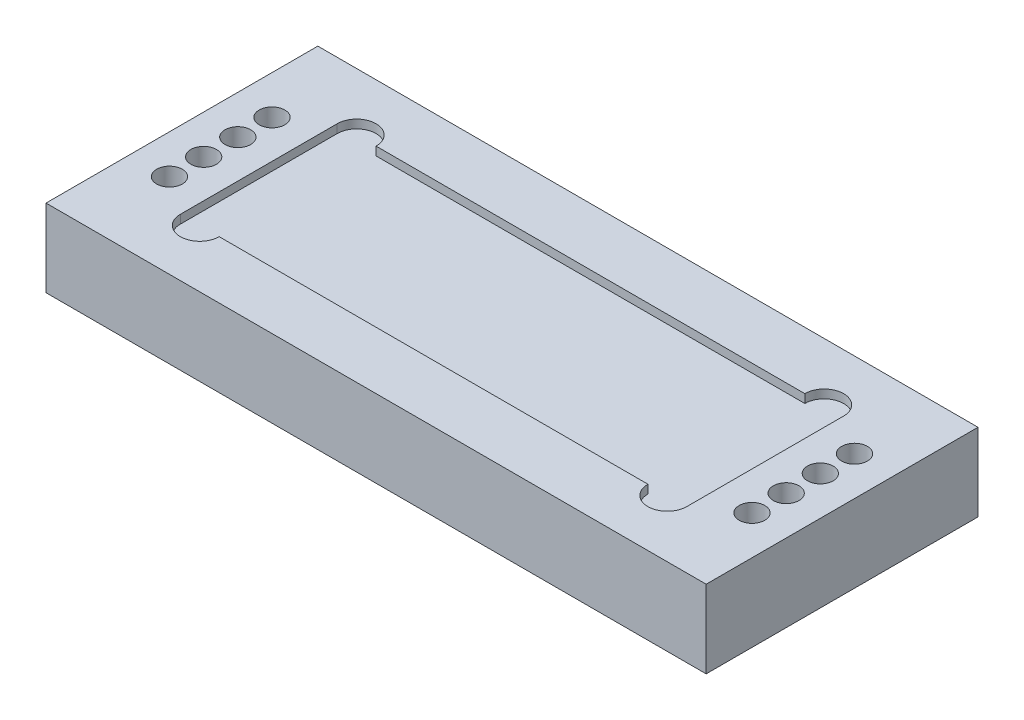
from build123d import *

# Parameters (mm, degrees)
SKETCH1_W             = 107.95
SKETCH1_H             = 44.45
BOSS_EXTRUDE1_DEPTH   = 12.7
CUT_EXTRUDE1_DEPTH    = 1.397
M5X0_8_TAPPED_HOLE1_D = 4.2


with BuildPart() as part:
    # Sketch1 → Boss-Extrude1 (new body)
    with BuildSketch(Plane(origin=(0, 0, 0), x_dir=(1, 0, 0), z_dir=(0, 1, 0))):
        Rectangle(SKETCH1_W, SKETCH1_H)
    extrude(amount=-BOSS_EXTRUDE1_DEPTH)

    # Sketch2 → Cut-Extrude1 (cut)
    with BuildSketch(Plane(origin=(0, 0, 0), x_dir=(1, 0, 0), z_dir=(0, 1, 0))):
        with BuildLine():
            Line((41.402, 12.827), (41.402, -12.827))
            ThreePointArc((41.402, -12.827), (38.227, -16.002), (35.052, -12.827))
            Line((35.052, -12.827), (-35.052, -12.827))
            ThreePointArc((-35.052, -12.827), (-38.227, -16.002), (-41.402, -12.827))
            Line((-41.402, -12.827), (-41.402, 12.827))
            ThreePointArc((-41.402, 12.827), (-38.227, 16.002), (-35.052, 12.827))
            Line((-35.052, 12.827), (35.052, 12.827))
            ThreePointArc((35.052, 12.827), (38.227, 16.002), (41.402, 12.827))
        make_face()
    extrude(amount=-CUT_EXTRUDE1_DEPTH, mode=Mode.SUBTRACT)

    # M5x0.8 Tapped Hole1 (through all)
    with Locations(Plane(origin=(0, 0, 0), x_dir=(1, 0, 0), z_dir=(0, 1, 0))):
        with Locations((-47.625, 8.382), (-47.625, 2.794), (-47.625, -2.794), (-47.625, -8.382), (47.625, -8.382), (47.625, -2.794), (47.625, 2.794), (47.625, 8.382)):
            Hole(M5X0_8_TAPPED_HOLE1_D / 2)


solid = part.part
